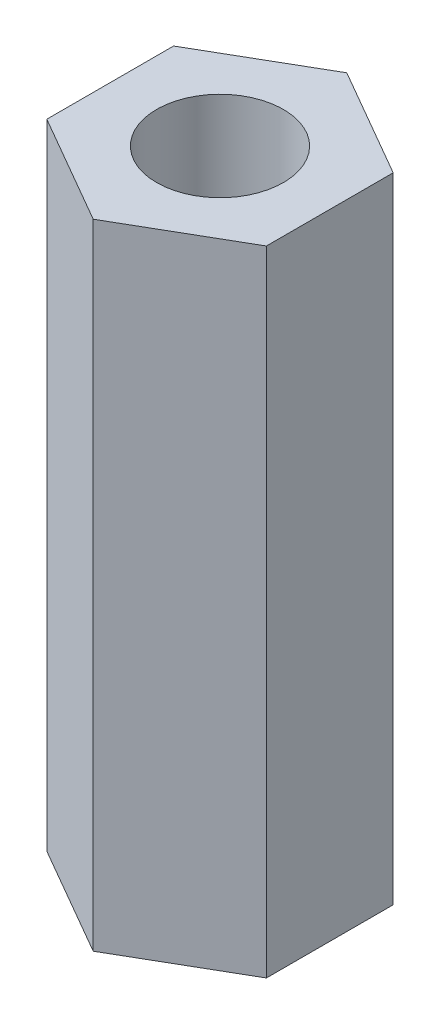
from build123d import *

# Parameters (mm, degrees)
SKETCH1_R           = 1.5
BOSS_EXTRUDE1_DEPTH = 15


with BuildPart() as part:
    # Sketch1 → Boss-Extrude1 (new body)
    with BuildSketch(Plane(origin=(0, 0, 0), x_dir=(1, 0, 0), z_dir=(0, 1, 0))):
        Polygon((0, 3), (-2.598076211, 1.5), (-2.598076211, -1.5), (0, -3), (2.598076211, -1.5), (2.598076211, 1.5), align=None)
        with Locations(Location((0, 0, 0), (0, 0, 270))):
            Circle(SKETCH1_R, mode=Mode.SUBTRACT)
    extrude(amount=BOSS_EXTRUDE1_DEPTH)


solid = part.part
